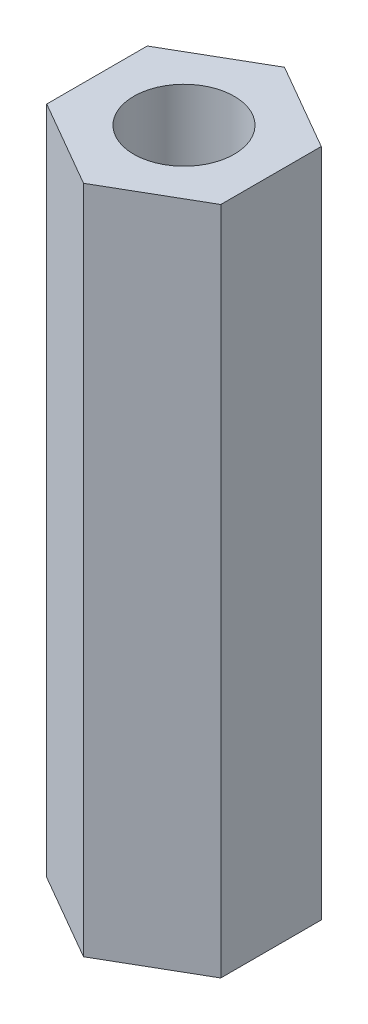
from build123d import *

# Parameters (mm, degrees)
SKETCH1_R           = 1.5
BOSS_EXTRUDE1_DEPTH = 20


with BuildPart() as part:
    # Sketch1 → Boss-Extrude1 (new body)
    with BuildSketch(Plane(origin=(0, 0, 0), x_dir=(1, 0, 0), z_dir=(0, 1, 0))):
        Polygon((0, 3), (-2.598076211, 1.5), (-2.598076211, -1.5), (0, -3), (2.598076211, -1.5), (2.598076211, 1.5), align=None)
        with Locations(Location((0, 0, 0), (0, 0, 270))):
            Circle(SKETCH1_R, mode=Mode.SUBTRACT)
    extrude(amount=BOSS_EXTRUDE1_DEPTH)


solid = part.part
